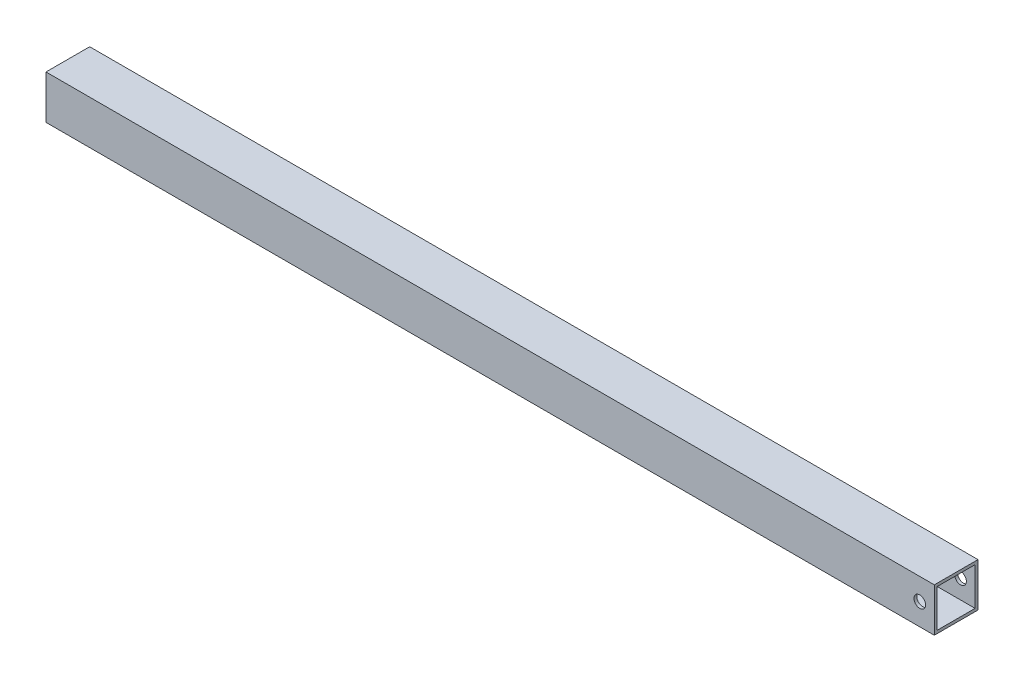
from build123d import *

# Parameters (mm, degrees)
SKETCH1_W           = 30
SKETCH1_H           = 30
SKETCH1_W_2         = 26
SKETCH1_H_2         = 26
BOSS_EXTRUDE1_DEPTH = 610
SKETCH2_R           = 4
CUT_EXTRUDE1_DEPTH  = 612.473629848


with BuildPart() as part:
    # Sketch1 → Boss-Extrude1 (new body)
    with BuildSketch(Plane(origin=(0, 0, 0), x_dir=(0, 0, -1), z_dir=(1, 0, 0))):
        with Locations((15, 15)):
            Rectangle(SKETCH1_W, SKETCH1_H)
        with Locations((15, 15)):
            Rectangle(SKETCH1_W_2, SKETCH1_H_2, mode=Mode.SUBTRACT)
    extrude(amount=BOSS_EXTRUDE1_DEPTH)

    # Sketch2 → Cut-Extrude1 (cut, through all)
    with BuildSketch(Plane.XY):
        with Locations((600, 15)):
            Circle(SKETCH2_R)
    extrude(amount=-CUT_EXTRUDE1_DEPTH, mode=Mode.SUBTRACT)


solid = part.part
